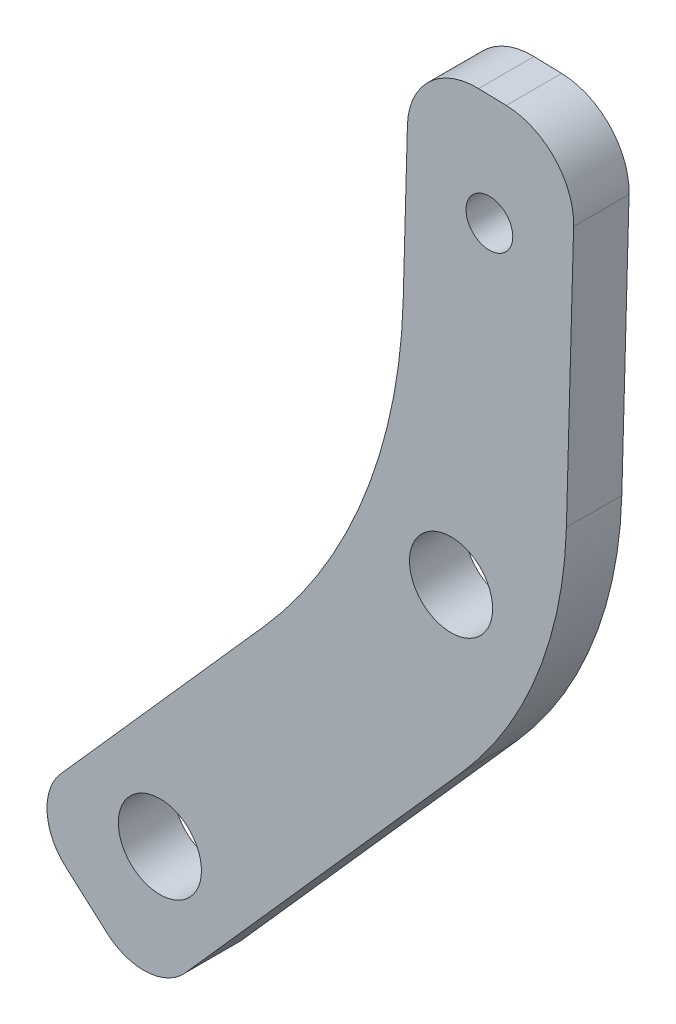
from build123d import *

# Parameters (mm, degrees)
SKETCH1_R           = 3
SKETCH1_R_2         = 1.688307965
BOSS_EXTRUDE1_DEPTH = 4
FILLET1_R           = 4
FILLET4_R           = 30
FILLET5_R           = 40
FILLET6_R           = 5
SKETCH6_R           = 3
CUT_EXTRUDE2_DEPTH  = 34


with BuildPart() as part:
    # Sketch1 → Boss-Extrude1 (new body)
    with BuildSketch(Plane.XY):
        Polygon((7.903848118, 3.731035494), (-21.954412971, -29.93622226), (-30.932348372, -21.974019303), (-3.972092158, 8.4255372), (-3.133542372, 39.046414738), (8.861960559, 38.717919044), align=None)
        with Locations((-21.135245367, -19.969830514)):
            Circle(SKETCH1_R, mode=Mode.SUBTRACT)
        with Locations((2.645211964, 30.885164937)):
            Circle(SKETCH1_R_2, mode=Mode.SUBTRACT)
    extrude(amount=BOSS_EXTRUDE1_DEPTH)

    # Fillet1
    fillet1_edges = [part.edges().sort_by_distance(p)[0] for p in [
        (-30.932348372, -21.974019303, 2),
        (-21.954412971, -29.93622226, 2),
    ]]
    fillet(fillet1_edges, radius=FILLET1_R)

    # Fillet4
    fillet4_edges = [part.edges().sort_by_distance(p)[0] for p in [
        (7.903848118, 3.731035494, 2),
    ]]
    fillet(fillet4_edges, radius=FILLET4_R)

    # Fillet5
    fillet5_edges = [part.edges().sort_by_distance(p)[0] for p in [
        (-3.972092158, 8.4255372, 2),
    ]]
    fillet(fillet5_edges, radius=FILLET5_R)

    # Fillet6
    fillet6_edges = [part.edges().sort_by_distance(p)[0] for p in [
        (-3.133542372, 39.046414738, 2),
        (8.861960559, 38.717919044, 2),
    ]]
    fillet(fillet6_edges, radius=FILLET6_R)

    # Sketch6 → Cut-Extrude2 (cut)
    with BuildSketch(Plane.XY.offset(4)):
        with Locations((-0.123058619, 6.904032873)):
            Circle(SKETCH6_R)
    extrude(amount=-CUT_EXTRUDE2_DEPTH, mode=Mode.SUBTRACT)


solid = part.part
